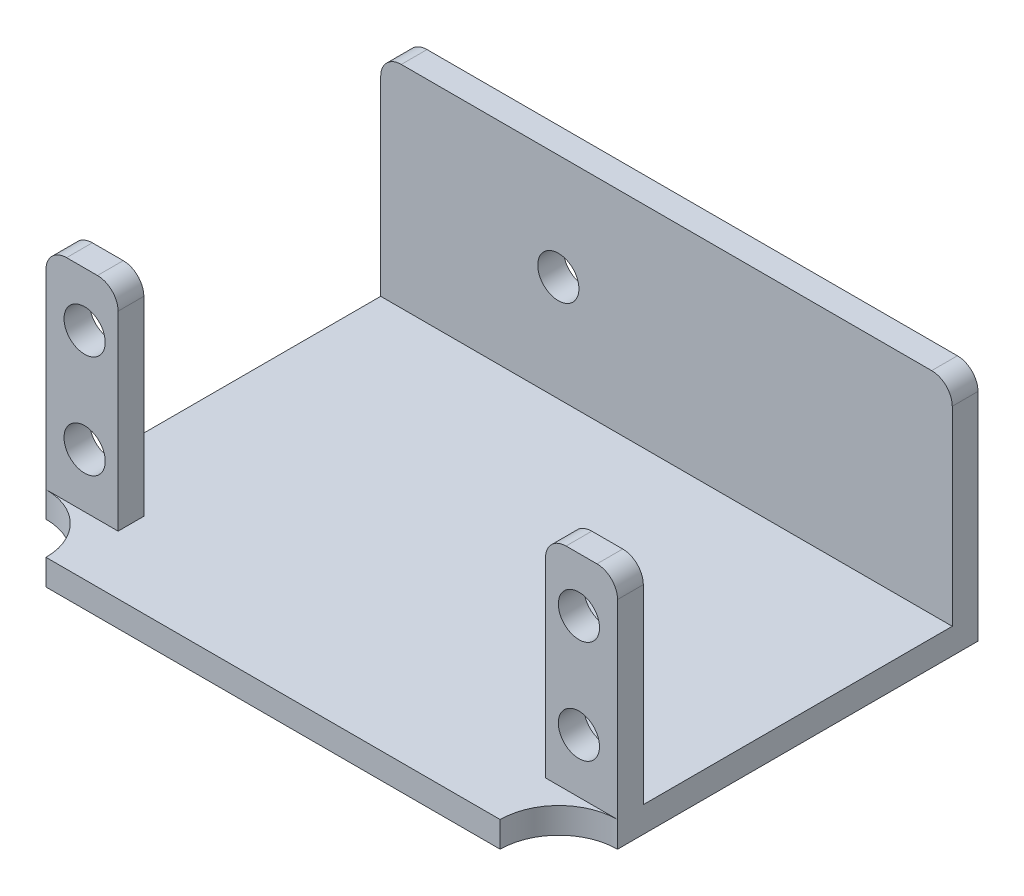
from build123d import *

# Parameters (mm, degrees)
SKETCH1_W                   = 55.5
SKETCH1_H                   = 38.2
BRACKETBASE_DEPTH           = 2.5
SKETCH2_W                   = 7
SKETCH2_H                   = 20.5
SERVOMOUNTINGHOLETABS_DEPTH = 2.5
SKETCH3_R                   = 2
SERVOMOUNTINGHOLES_DEPTH    = 2.5
SKETCH4_W                   = 55.5
SKETCH4_H                   = 2.5
BASEWALL_DEPTH              = 23
SKETCH6_R                   = 5.7
BASETRIM_DEPTH              = 2.5
FILLET1_R                   = 2
SKETCH7_R                   = 2
M4MOUNTINGHOLE_DEPTH        = 10


with BuildPart() as part:
    # Sketch1 → bracketBase (new body)
    with BuildSketch(Plane(origin=(0, 0, 0), x_dir=(1, 0, 0), z_dir=(0, 1, 0))):
        with Locations((27.75, 19.1)):
            Rectangle(SKETCH1_W, SKETCH1_H)
    extrude(amount=BRACKETBASE_DEPTH)

    # Sketch2 → servoMountingHoleTabs (add)
    with BuildSketch(Plane.XY.offset(-8.2)):
        with Locations((3.5, 12.75)):
            Rectangle(SKETCH2_W, SKETCH2_H)
        with Locations((52, 12.75)):
            Rectangle(SKETCH2_W, SKETCH2_H)
    extrude(amount=SERVOMOUNTINGHOLETABS_DEPTH)

    # Sketch3 → servoMountingHoles (cut)
    with BuildSketch(Plane.XY.offset(-5.7)):
        with Locations((3.75, 17.75)):
            Circle(SKETCH3_R)
        with Locations(Location((3.75, 7.75, 0), (0, 0, 180))):
            Circle(SKETCH3_R)
        with Locations((51.75, 7.75)):
            Circle(SKETCH3_R)
        with Locations(Location((51.75, 17.75, 0), (0, 0, 180))):
            Circle(SKETCH3_R)
    extrude(amount=-SERVOMOUNTINGHOLES_DEPTH, mode=Mode.SUBTRACT)

    # Sketch4 → baseWall (add)
    with BuildSketch(Plane(origin=(0, 0, 0), x_dir=(1, 0, 0), z_dir=(0, 1, 0))):
        with Locations((27.75, 39.45)):
            Rectangle(SKETCH4_W, SKETCH4_H)
    extrude(amount=BASEWALL_DEPTH)

    # Sketch6 → baseTrim (cut)
    with BuildSketch(Plane(origin=(0, 2.5, 0), x_dir=(1, 0, 0), z_dir=(0, 1, 0))):
        Circle(SKETCH6_R)
        with Locations((55.5, 0)):
            Circle(SKETCH6_R)
    extrude(amount=-BASETRIM_DEPTH, mode=Mode.SUBTRACT)

    # Fillet1
    fillet1_edges = [part.edges().sort_by_distance(p)[0] for p in [
        (0, 23, -6.95),
        (7, 23, -6.95),
        (55.5, 23, -6.95),
        (48.5, 23, -6.95),
        (55.5, 23, -39.45),
        (0, 23, -39.45),
    ]]
    fillet(fillet1_edges, radius=FILLET1_R)

    # Sketch7 → M4mountingHole (cut)
    with BuildSketch(Plane(origin=(0, 0, -40.7), x_dir=(-1, 0, 0), z_dir=(0, 0, -1))):
        with Locations((-17.25, 12.75)):
            Circle(SKETCH7_R)
    extrude(amount=-M4MOUNTINGHOLE_DEPTH, mode=Mode.SUBTRACT)


solid = part.part
